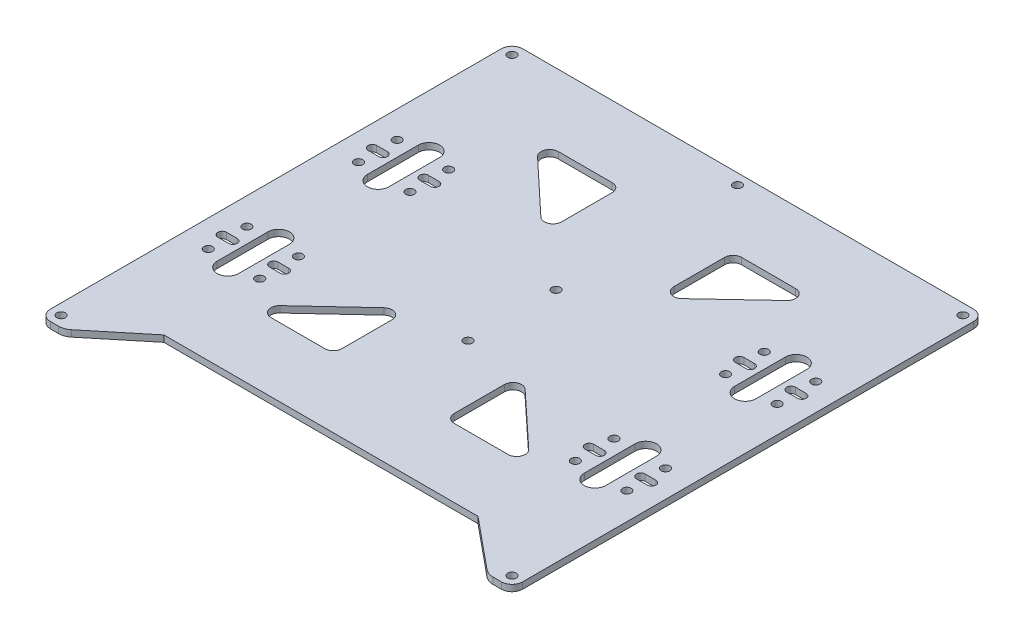
from build123d import *
from build123d.topology import SkipClean

# Parameters (mm, degrees)
SKETCH1_R            = 2
BOSS_EXTRUDE2_DEPTH  = 3
FILLET1_R            = 4
FILLET1_OF_MIRROR1_R = 4


with BuildPart() as part:
    # Sketch1 → Boss-Extrude2 (new body)
    with BuildSketch(Plane(origin=(0, 0, 0), x_dir=(1, 0, 0), z_dir=(0, 1, 0))):
        with BuildLine():
            Line((-0.567360549, 109.999952103), (-0.567360549, 106.999952103))
            ThreePointArc((-0.567360549, 106.999952103), (1.432639451, 104.999952103), (-0.567360549, 102.999952103))
            Line((-0.567360549, 102.999952103), (-0.567360549, 22.499952103))
            ThreePointArc((-0.567360549, 22.499952103), (1.432639451, 20.499952103), (-0.567360549, 18.499952103))
            Line((-0.567360549, 18.499952103), (-0.567360549, -18.500047897))
            ThreePointArc((-0.567360549, -18.500047897), (1.432639451, -20.500047897), (-0.567360549, -22.500047897))
            Line((-0.567360549, -22.500047897), (-0.567360549, -89.000047897))
            Line((-0.567360549, -89.000047897), (72.593143282, -89.000047897))
            Line((72.593143282, -89.000047897), (96.205566979, -108.407802041))
            ThreePointArc((96.205566979, -108.407802041), (98.289670456, -109.589975021), (100.650361138, -110.000047897))
            Line((100.650361138, -110.000047897), (104.432639451, -110.000047897))
            ThreePointArc((104.432639451, -110.000047897), (107.968173357, -108.535581803), (109.432639451, -105.000047897))
            Line((109.432639451, -105.000047897), (109.432639451, -4.7897e-05))
            Line((109.432639451, -4.7897e-05), (109.432639451, 104.999952103))
            ThreePointArc((109.432639451, 104.999952103), (107.968173357, 108.535486009), (104.432639451, 109.999952103))
            Line((104.432639451, 109.999952103), (-0.567360549, 109.999952103))
        make_face()
        with Locations(Location((104.432639451, 104.999952103, 0), (0, 0, 90))):
            Circle(SKETCH1_R, mode=Mode.SUBTRACT)
        with Locations(Location((104.432639451, -105.000047897, 0), (0, 0, 270))):
            Circle(SKETCH1_R, mode=Mode.SUBTRACT)
        with Locations(Location((96.932639451, 25.999952103, 0), (0, 0, 90))):
            Circle(SKETCH1_R, mode=Mode.SUBTRACT)
        with Locations(Location((72.932639451, 25.999952103, 0), (0, 0, 90))):
            Circle(SKETCH1_R, mode=Mode.SUBTRACT)
        with Locations(Location((72.932639451, 43.999952103, 0), (0, 0, 90))):
            Circle(SKETCH1_R, mode=Mode.SUBTRACT)
        with Locations(Location((96.932639451, -44.000047897, 0), (0, 0, 270))):
            Circle(SKETCH1_R, mode=Mode.SUBTRACT)
        with Locations(Location((72.932639451, -44.000047897, 0), (0, 0, 270))):
            Circle(SKETCH1_R, mode=Mode.SUBTRACT)
        with Locations(Location((72.932639451, -26.000047897, 0), (0, 0, 270))):
            Circle(SKETCH1_R, mode=Mode.SUBTRACT)
        with Locations(Location((96.932639451, -26.000047897, 0), (0, 0, 270))):
            Circle(SKETCH1_R, mode=Mode.SUBTRACT)
        with Locations(Location((96.932639451, 43.999952103, 0), (0, 0, 90))):
            Circle(SKETCH1_R, mode=Mode.SUBTRACT)
        Polygon((25.578501747, 39.999952103), (25.578501747, 76.833921846), (64.808861855, 76.833921846), align=None, mode=Mode.SUBTRACT)
        Polygon((25.578501747, -20.500095793), (25.578501747, -57.061589457), (64.808861855, -57.061589457), align=None, mode=Mode.SUBTRACT)
        with BuildLine():
            Line((89.932639451, -23.164859069), (89.932639451, -46.835236724))
            ThreePointArc((89.932639451, -46.835236724), (84.932639451, -51.835236724), (79.932639451, -46.835236724))
            Line((79.932639451, -46.835236724), (79.932639451, -23.164859069))
            ThreePointArc((79.932639451, -23.164859069), (84.932639451, -18.164859069), (89.932639451, -23.164859069))
        make_face(mode=Mode.SUBTRACT)
        with BuildLine():
            Line((70.432639451, -33.000047897), (75.432639451, -33.000047897))
            ThreePointArc((75.432639451, -33.000047897), (77.432639451, -35.000047897), (75.432639451, -37.000047897))
            Line((75.432639451, -37.000047897), (70.432639451, -37.000047897))
            ThreePointArc((70.432639451, -37.000047897), (68.432639451, -35.000047897), (70.432639451, -33.000047897))
        make_face(mode=Mode.SUBTRACT)
        with BuildLine():
            Line((94.432639451, -33.000047897), (99.432639451, -33.000047897))
            ThreePointArc((99.432639451, -33.000047897), (101.432639451, -35.000047897), (99.432639451, -37.000047897))
            Line((99.432639451, -37.000047897), (94.432639451, -37.000047897))
            ThreePointArc((94.432639451, -37.000047897), (92.432639451, -35.000047897), (94.432639451, -33.000047897))
        make_face(mode=Mode.SUBTRACT)
        with BuildLine():
            Line((89.932639451, 23.164763276), (89.932639451, 46.835140931))
            ThreePointArc((89.932639451, 46.835140931), (84.932639451, 51.835140931), (79.932639451, 46.835140931))
            Line((79.932639451, 46.835140931), (79.932639451, 23.164763276))
            ThreePointArc((79.932639451, 23.164763276), (84.932639451, 18.164763276), (89.932639451, 23.164763276))
        make_face(mode=Mode.SUBTRACT)
        with BuildLine():
            Line((70.432639451, 32.999952103), (75.432639451, 32.999952103))
            ThreePointArc((75.432639451, 32.999952103), (77.432639451, 34.999952103), (75.432639451, 36.999952103))
            Line((75.432639451, 36.999952103), (70.432639451, 36.999952103))
            ThreePointArc((70.432639451, 36.999952103), (68.432639451, 34.999952103), (70.432639451, 32.999952103))
        make_face(mode=Mode.SUBTRACT)
        with BuildLine():
            Line((94.432639451, 32.999952103), (99.432639451, 32.999952103))
            ThreePointArc((99.432639451, 32.999952103), (101.432639451, 34.999952103), (99.432639451, 36.999952103))
            Line((99.432639451, 36.999952103), (94.432639451, 36.999952103))
            ThreePointArc((94.432639451, 36.999952103), (92.432639451, 34.999952103), (94.432639451, 32.999952103))
        make_face(mode=Mode.SUBTRACT)
    boss_extrude2 = extrude(amount=BOSS_EXTRUDE2_DEPTH)

    # Fillet1
    fillet1_edges = [part.edges().sort_by_distance(p)[0] for p in [
        (25.578501747, 1.5, -39.999952103),
        (64.808861855, 1.5, -76.833921846),
        (25.578501747, 1.5, -76.833921846),
        (64.808861855, 1.5, 57.061589457),
        (25.578501747, 1.5, 20.500095793),
        (25.578501747, 1.5, 57.061589457),
    ]]
    fillet(fillet1_edges, radius=FILLET1_R)

    # Mirror1: Boss-Extrude2 across plane
    with SkipClean():  # the faces are left unmerged after this step: merging them gives an invalid solid
        add(boss_extrude2.mirror(Plane(origin=(-0.567360549, 3, -102.999952103), x_dir=(0, 0, 1), z_dir=(1, 0, 0))))

    # Fillet1 of Mirror1
    fillet1_of_mirror1_edges = [part.edges().sort_by_distance(p)[0] for p in [
        (-26.713222844, 1.5, -39.999952103),
        (-65.943582953, 1.5, -76.833921846),
        (-26.713222844, 1.5, -76.833921846),
        (-65.943582953, 1.5, 57.061589457),
        (-26.713222844, 1.5, 20.500095793),
        (-26.713222844, 1.5, 57.061589457),
    ]]
    fillet(fillet1_of_mirror1_edges, radius=FILLET1_OF_MIRROR1_R)


solid = part.part
